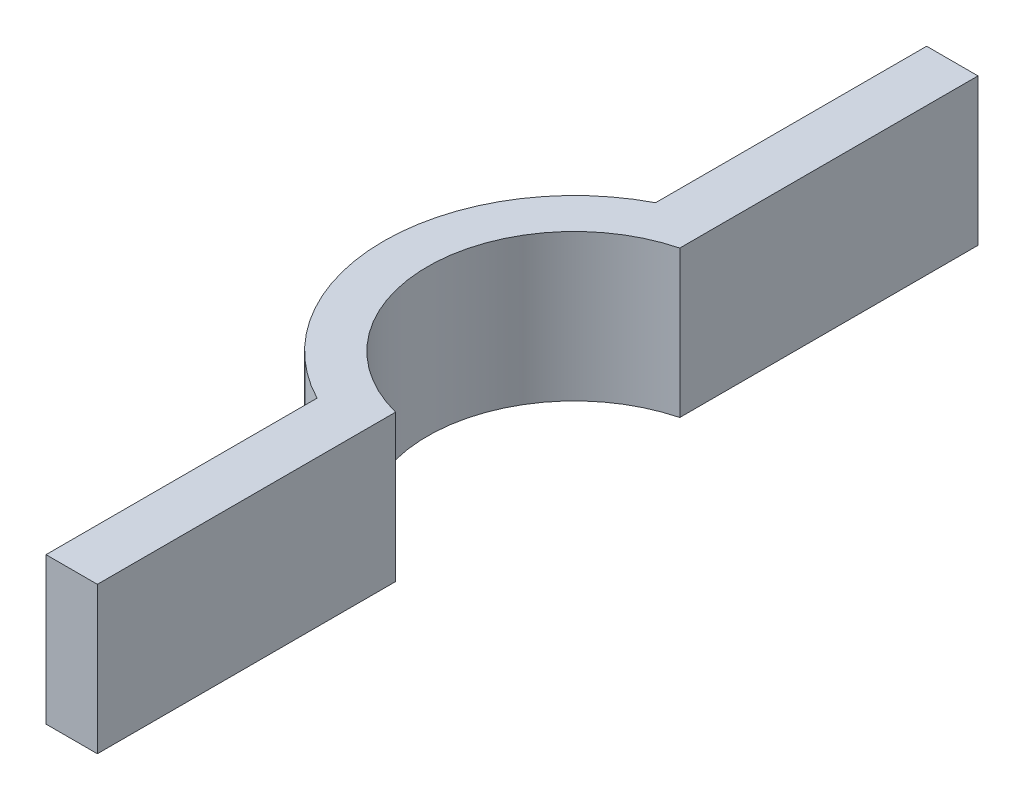
from build123d import *

# Parameters (mm, degrees)
SKETCH_1_R          = 13
EXTRUDE_1_DEPTH     = 10
SKETCH_2_W          = 12
SKETCH_2_H          = 60
EXTRUDE_2_DEPTH     = 10
SKETCH_3_R          = 10
CUT_EXTRUDE_1_DEPTH = 10
SKETCH_4_W          = 32.688093459
SKETCH_4_H          = 61.579585558
CUT_EXTRUDE_2_DEPTH = 10


with BuildPart() as part:
    # 草图1 → 凸台-拉伸1 (new body)
    with BuildSketch(Plane(origin=(0, 0, 0), x_dir=(1, 0, 0), z_dir=(0, 1, 0))):
        with Locations(Location((0, 0, 0), (0, 0, 270))):
            Circle(SKETCH_1_R)
    extrude(amount=EXTRUDE_1_DEPTH)

    # 草图2 → 凸台-拉伸2 (add)
    with BuildSketch(Plane(origin=(0, 10, 0), x_dir=(1, 0, 0), z_dir=(0, 1, 0))):
        Rectangle(SKETCH_2_W, SKETCH_2_H)
    extrude(amount=-EXTRUDE_2_DEPTH)

    # 草图3 → 切除-拉伸1 (cut)
    with BuildSketch(Plane(origin=(0, 10, 0), x_dir=(1, 0, 0), z_dir=(0, 1, 0))):
        with Locations(Location((0, 0, 0), (0, 0, 270))):
            Circle(SKETCH_3_R)
    extrude(amount=-CUT_EXTRUDE_1_DEPTH, mode=Mode.SUBTRACT)

    # 草图4 → 切除-拉伸2 (cut)
    with BuildSketch(Plane(origin=(0, 10, 0), x_dir=(1, 0, 0), z_dir=(0, 1, 0))):
        with Locations((13.84404673, -0.789792779)):
            Rectangle(SKETCH_4_W, SKETCH_4_H)
    extrude(amount=-CUT_EXTRUDE_2_DEPTH, mode=Mode.SUBTRACT)


solid = part.part
